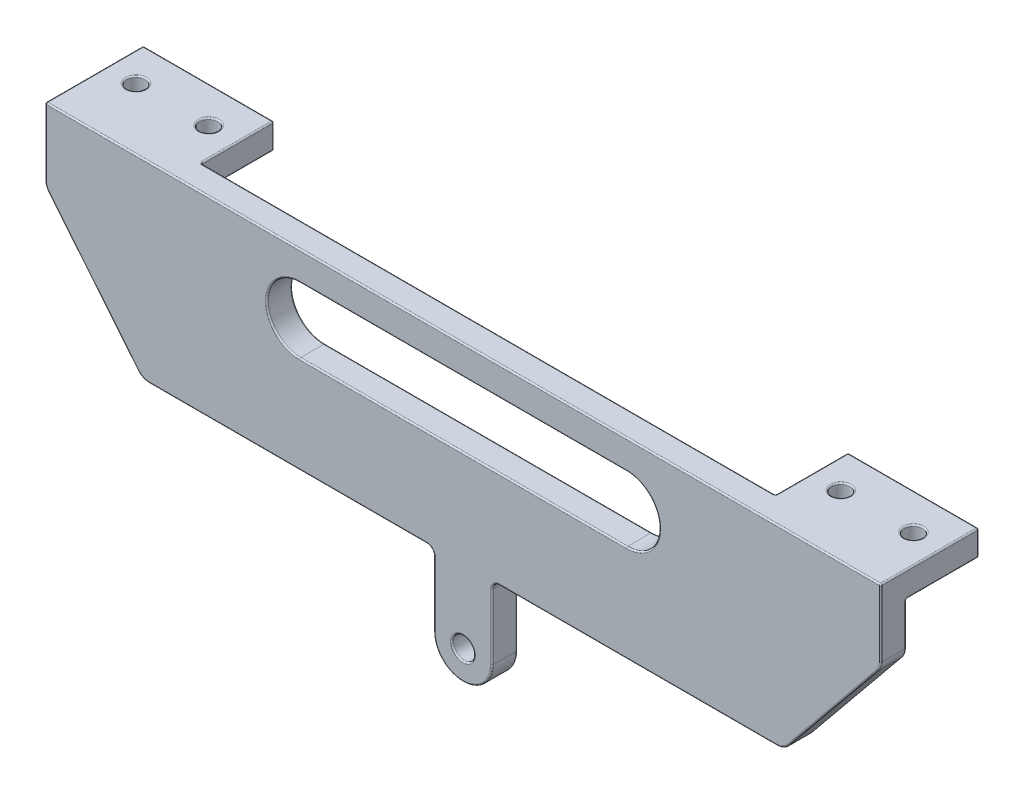
from build123d import *

# Parameters (mm, degrees)
SKETCH4_R           = 1.5
BOSS_EXTRUDE1_DEPTH = 3.5
SKETCH5_W           = 18
SKETCH5_H           = 10
SKETCH5_R           = 1.25
BOSS_EXTRUDE2_DEPTH = 3.5
FILLET1_R           = 2
FILLET2_R           = 1
FILLET3_R           = 0.2


with BuildPart() as part:
    # Sketch4 → Boss-Extrude1 (new body)
    with BuildSketch(Plane.XY):
        with BuildLine():
            Line((57.5, 96.35), (57.5, 86.35))
            Line((57.5, 86.35), (44.142135624, 70))
            Line((44.142135624, 70), (4, 70))
            Line((4, 70), (4, 60))
            ThreePointArc((4, 60), (0, 56), (-4, 60))
            Line((-4, 60), (-4, 70))
            Line((-4, 70), (-44.142135624, 70))
            Line((-44.142135624, 70), (-57.5, 86.35))
            Line((-57.5, 86.35), (-57.5, 96.35))
            Line((-57.5, 96.35), (57.5, 96.35))
        make_face()
        with Locations((0, 60)):
            Circle(SKETCH4_R, mode=Mode.SUBTRACT)
        with BuildLine():
            Line((-22.479906762, 92.35), (22.520093238, 92.35))
            ThreePointArc((22.520093238, 92.35), (27.020093238, 87.85), (22.520093238, 83.35))
            Line((22.520093238, 83.35), (-22.479906762, 83.35))
            ThreePointArc((-22.479906762, 83.35), (-26.979906762, 87.85), (-22.479906762, 92.35))
        make_face(mode=Mode.SUBTRACT)
    extrude(amount=BOSS_EXTRUDE1_DEPTH)

    # Sketch5 → Boss-Extrude2 (add)
    # profile 1 of 2: a face of its own
    with BuildSketch(Plane(origin=(0, 96.35, 0), x_dir=(1, 0, 0), z_dir=(0, 1, 0))):
        with Locations((-48.5, 5)):
            Rectangle(SKETCH5_W, SKETCH5_H)
        with Locations(Location((-53.5, 5, 0), (0, 0, 270))):
            Circle(SKETCH5_R, mode=Mode.SUBTRACT)
        with Locations(Location((-43.5, 5, 0), (0, 0, 270))):
            Circle(SKETCH5_R, mode=Mode.SUBTRACT)
    # profile 2 of 2: a face of its own
    with BuildSketch(Plane(origin=(0, 96.35, 0), x_dir=(1, 0, 0), z_dir=(0, 1, 0))):
        with Locations((48.5, 5)):
            Rectangle(SKETCH5_W, SKETCH5_H)
        with Locations(Location((43.5, 5, 0), (0, 0, 90))):
            Circle(SKETCH5_R, mode=Mode.SUBTRACT)
        with Locations(Location((53.5, 5, 0), (0, 0, 90))):
            Circle(SKETCH5_R, mode=Mode.SUBTRACT)
    extrude(amount=-BOSS_EXTRUDE2_DEPTH)

    # Fillet1
    fillet1_edges = [part.edges().sort_by_distance(p)[0] for p in [
        (57.5, 86.35, 1.75),
        (44.142135624, 70, 1.75),
        (-44.142135624, 70, 1.75),
        (-57.5, 86.35, 1.75),
    ]]
    fillet(fillet1_edges, radius=FILLET1_R)

    # Fillet2
    fillet2_edges = [part.edges().sort_by_distance(p)[0] for p in [
        (4, 70, 1.75),
        (-4, 70, 1.75),
    ]]
    fillet(fillet2_edges, radius=FILLET2_R)

    # Fillet3
    fillet3_edges = [part.edges().sort_by_distance(p)[0] for p in [
        (24.09675299, 70, 0),
        (24.09675299, 70, 3.5),
        (-4, 64.5, 0),
        (-4, 64.5, 3.5),
        (4.292893219, 69.707106781, 0),
        (4.292893219, 69.707106781, 3.5),
        (-4.292893219, 69.707106781, 0),
        (4, 64.5, 0),
        (-4.292893219, 69.707106781, 3.5),
        (0, 56, 0),
        (57.5, 96.35, -3.25),
        (-57.5, 96.35, -3.25),
        (0, 56, 3.5),
        (-1.5, 60, 0),
        (-1.5, 60, 3.5),
        (4, 64.5, 3.5),
        (-26.979906762, 87.85, 0),
        (0.020093238, 83.35, 0),
        (27.020093238, 87.85, 0),
        (0.020093238, 92.35, 0),
        (-26.979906762, 87.85, 3.5),
        (0.020093238, 83.35, 3.5),
        (27.020093238, 87.85, 3.5),
        (0.020093238, 92.35, 3.5),
        (0, 96.35, 3.5),
        (-57.5, 89.956562364, 0),
        (-57.5, 92.85, -5),
        (-48.5, 92.85, -10),
        (-57.5, 94.6, -10),
        (-39.5, 92.85, -5),
        (-39.5, 94.6, -10),
        (-48.5, 92.85, 0),
        (-39.5, 94.6, 0),
        (-43.5, 92.85, -6.25),
        (-53.5, 92.85, -6.25),
        (-39.5, 96.35, -5),
        (-48.5, 96.35, -10),
        (-53.5, 96.35, -6.25),
        (-43.5, 96.35, -6.25),
        (0, 96.35, 0),
        (48.5, 92.85, -10),
        (39.5, 94.6, -10),
        (57.5, 92.85, -5),
        (57.5, 94.6, -10),
        (48.5, 92.85, 0),
        (39.5, 92.85, -5),
        (39.5, 94.6, 0),
        (53.5, 92.85, -3.75),
        (43.5, 92.85, -3.75),
        (48.5, 96.35, -10),
        (39.5, 96.35, -5),
        (43.5, 96.35, -3.75),
        (53.5, 96.35, -3.75),
        (-24.09675299, 70, 0),
        (-24.09675299, 70, 3.5),
        (57.5, 89.956562364, 0),
        (50.895568258, 78.266188402, 0),
        (-50.895568258, 78.266188402, 0),
        (57.383829947, 86.391421869, 0),
        (44.050609264, 70.192965423, 0),
        (-57.383829947, 86.391421869, 0),
        (-44.050609264, 70.192965423, 0),
        (-50.895568258, 78.266188402, 3.5),
        (-57.5, 91.706562364, 3.5),
        (50.895568258, 78.266188402, 3.5),
        (57.5, 91.706562364, 3.5),
        (57.383829947, 86.391421869, 3.5),
        (44.050609264, 70.192965423, 3.5),
        (-57.383829947, 86.391421869, 3.5),
        (-44.050609264, 70.192965423, 3.5),
    ]]
    fillet(fillet3_edges, radius=FILLET3_R)


solid = part.part
